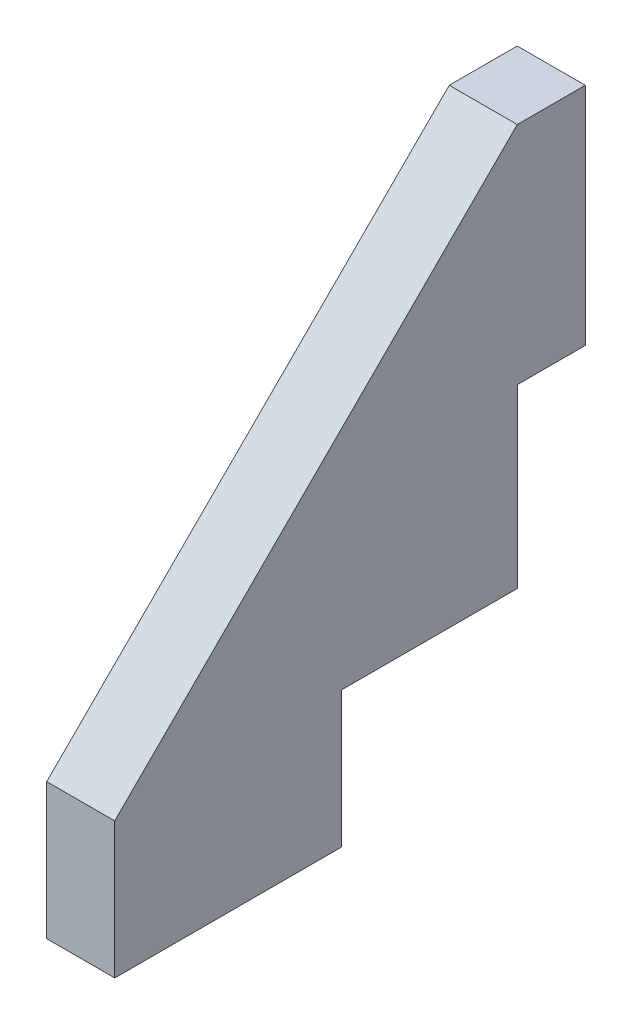
from build123d import *

# Parameters (mm, degrees)
BOSS_EXTRUDE1_DEPTH = 3


with BuildPart() as part:
    # Sketch1 → Boss-Extrude1 (new body)
    with BuildSketch(Plane(origin=(0, 0, 0), x_dir=(0, 0, -1), z_dir=(1, 0, 0))):
        Polygon((-3, -9.935360412), (-3, -4.967680206), (-3, 0), (-20.75, -17.717680206), (-15.75, -17.717680206), (-10.75, -17.717680206), (-3, -17.717680206), align=None)
        Polygon((-3, 0), (-3, -4.967680206), (-3, -9.935360412), (0, -9.935360412), (0, 0), align=None)
        Polygon((-15.75, -17.717680206), (-20.75, -17.717680206), (-20.75, -23.717680206), (-10.75, -23.717680206), (-10.75, -17.717680206), align=None)
    extrude(amount=BOSS_EXTRUDE1_DEPTH)


solid = part.part
